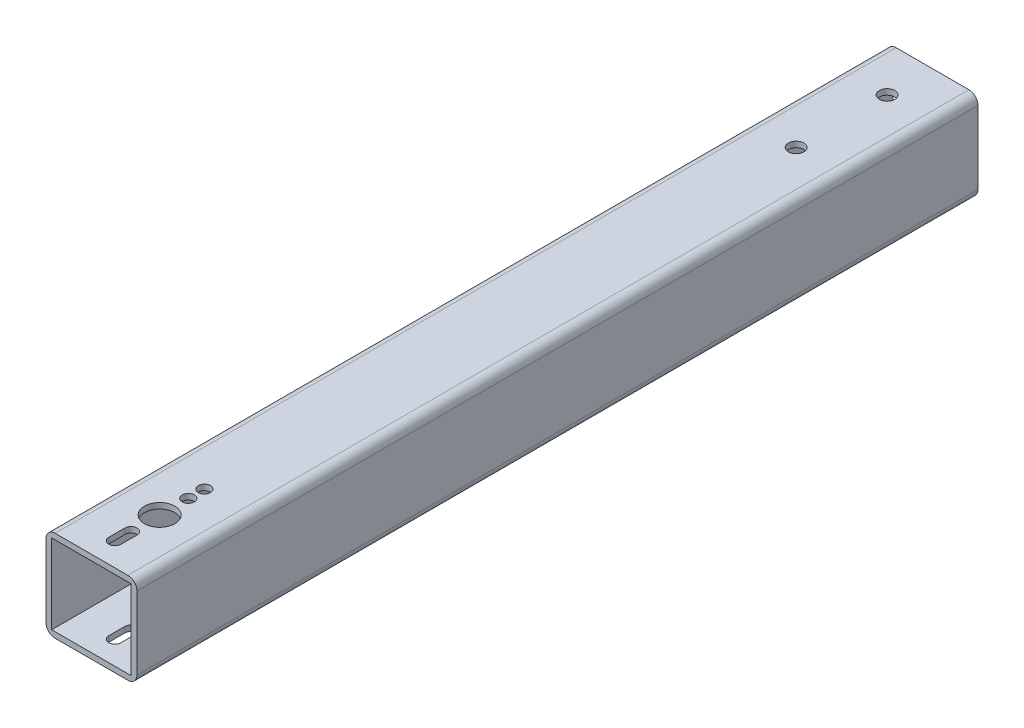
from build123d import *

# Parameters (mm, degrees)
SKETCH1_W               = 25.4
SKETCH1_H               = 25.4
SKETCH1_W_2             = 22.225
SKETCH1_H_2             = 22.225
BOSS_EXTRUDE1_DEPTH     = 234.95
FILLET1_R               = 2.54
SKETCH2_R               = 2.159
CUT_EXTRUDE1_DEPTH      = 238.560919126
CUT_EXTRUDE2_DEPTH      = 238.560919126
CUT_EXTRUDE2_DEPTH_BACK = 238.560919126
SKETCH3_R               = 1.7
SKETCH3_R_2             = 4.25


with BuildPart() as part:
    # Sketch1 → Boss-Extrude1 (new body)
    with BuildSketch(Plane.XY):
        with Locations((-11.559591837, -1.275183673)):
            Rectangle(SKETCH1_W, SKETCH1_H)
        with Locations((-11.559591837, -1.275183673)):
            Rectangle(SKETCH1_W_2, SKETCH1_H_2, mode=Mode.SUBTRACT)
    extrude(amount=BOSS_EXTRUDE1_DEPTH)

    # Fillet1
    fillet1_edges = [part.edges().sort_by_distance(p)[0] for p in [
        (-24.259591837, 11.424816327, 117.475),
        (1.140408163, 11.424816327, 117.475),
        (1.140408163, -13.975183673, 117.475),
        (-24.259591837, -13.975183673, 117.475),
    ]]
    fillet(fillet1_edges, radius=FILLET1_R)

    # Sketch2 → Cut-Extrude1 (cut, through all)
    with BuildSketch(Plane(origin=(0, 11.424816327, 0), x_dir=(1, 0, 0), z_dir=(0, 1, 0))):
        with Locations(Location((-11.559591837, -12.7, 0), (0, 0, 270))):
            Circle(SKETCH2_R)
        with Locations(Location((-11.559591837, -38.1, 0), (0, 0, 270))):
            Circle(SKETCH2_R)
    extrude(amount=-CUT_EXTRUDE1_DEPTH, mode=Mode.SUBTRACT)

    # Sketch3 → Cut-Extrude2 (cut, two sides: drawn at the far end of the back side and taken through both)
    with BuildSketch(Plane(origin=(0, 11.424816327, 0), x_dir=(1, 0, 0), z_dir=(0, 1, 0)).offset(-CUT_EXTRUDE2_DEPTH_BACK)):
        with Locations(Location((-11.559591837, -207.9, 0), (0, 0, 90))):
            Circle(SKETCH3_R)
        with Locations(Location((-11.559591837, -203.4, 0), (0, 0, 90))):
            Circle(SKETCH3_R)
        with Locations(Location((-11.559591837, -215.9, 0), (0, 0, 90))):
            Circle(SKETCH3_R_2)
        with BuildLine():
            Line((-9.859591837, -223.9), (-9.859591837, -228.4))
            ThreePointArc((-9.859591837, -228.4), (-11.559591837, -230.1), (-13.259591837, -228.4))
            Line((-13.259591837, -228.4), (-13.259591837, -223.9))
            ThreePointArc((-13.259591837, -223.9), (-11.559591837, -222.2), (-9.859591837, -223.9))
        make_face()
    extrude(amount=CUT_EXTRUDE2_DEPTH + CUT_EXTRUDE2_DEPTH_BACK, mode=Mode.SUBTRACT)


solid = part.part
